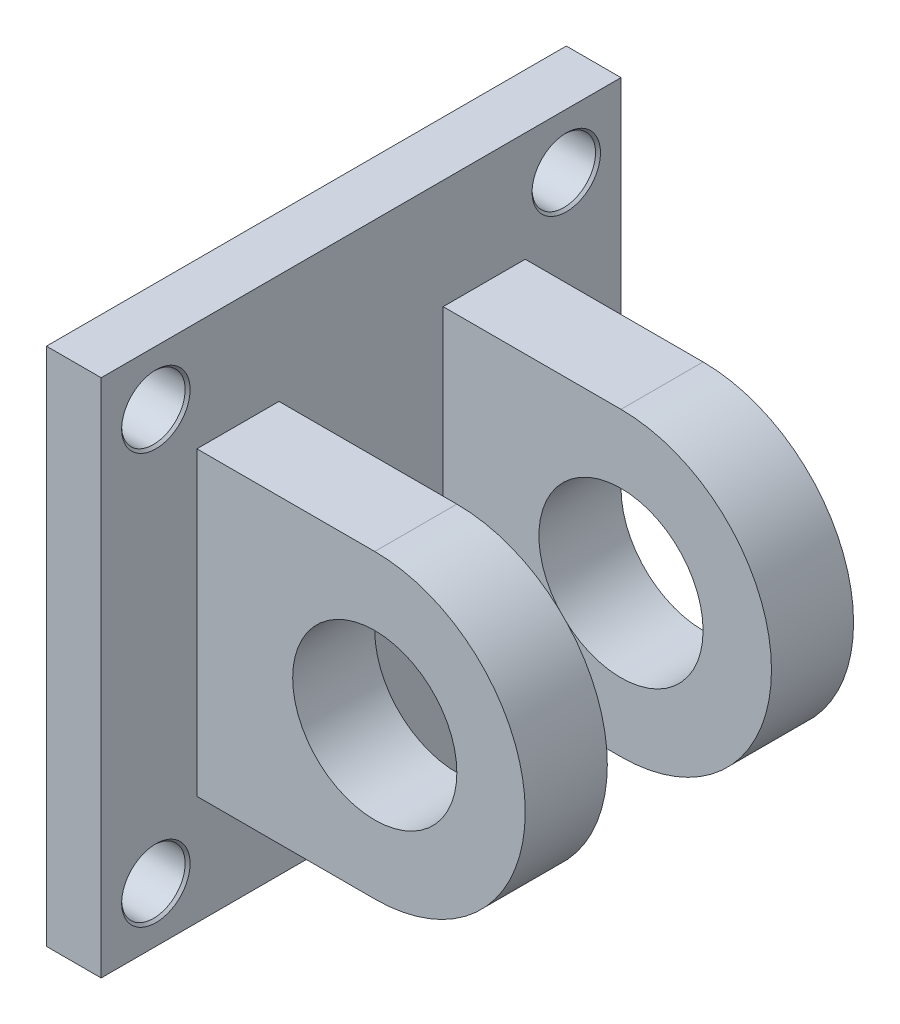
from build123d import *

# Parameters (mm, degrees)
SKETCH1_W                     = 241.3
SKETCH1_H                     = 241.3
BOSS_EXTRUDE1_DEPTH           = 25.4
BOSS_EXTRUDE2_DEPTH           = 38.1
BOSS_EXTRUDE3_START           = -38.1
BOSS_EXTRUDE3_DEPTH           = 38.1
F_1_1_8_CLEARANCE_HOLE1_D     = 29.45892
F_1_1_8_CLEARANCE_HOLE1_DEPTH = 177.8
F_1_1_8_CLEARANCE_HOLE2_D     = 29.45892
SKETCH8_W                     = 38.1
SKETCH8_H                     = 82.55
HOLE2_D                       = 76.2
HOLE2_DEPTH                   = 82.55
CHAMFER1_SIZE                 = 1.14554


with BuildPart() as part:
    # Sketch1 → Boss-Extrude1 (new body)
    with BuildSketch(Plane(origin=(25.4, 0, 0), x_dir=(0, 0, -1), z_dir=(1, 0, 0))):
        Rectangle(SKETCH1_W, SKETCH1_H)
    extrude(amount=-BOSS_EXTRUDE1_DEPTH)

    # Sketch2 → Boss-Extrude2 (add)
    with BuildSketch(Plane(origin=(0, 0, -76.2), x_dir=(-1, 0, 0), z_dir=(0, 0, -1))):
        with BuildLine():
            Line((-25.4, -69.85), (-25.4, 69.85))
            Line((-25.4, 69.85), (-107.95, 69.85))
            ThreePointArc((-107.95, 69.85), (-177.8, 0), (-107.95, -69.85))
            Line((-107.95, -69.85), (-25.4, -69.85))
        make_face()
    extrude(amount=-BOSS_EXTRUDE2_DEPTH)

    # Sketch3 → Boss-Extrude3 (add)
    with BuildSketch(Plane.XY.offset(76.2).offset(BOSS_EXTRUDE3_START)):
        with BuildLine():
            Line((25.4, 69.85), (25.4, -69.85))
            Line((25.4, -69.85), (107.95, -69.85))
            ThreePointArc((107.95, -69.85), (177.8, 0), (107.95, 69.85))
            Line((107.95, 69.85), (25.4, 69.85))
        make_face()
    extrude(amount=BOSS_EXTRUDE3_DEPTH)

    # 1-1/8 Clearance Hole1
    with Locations(Plane.ZY):
        with Locations((-95.25, -95.25), (95.25, -95.25)):
            Hole(F_1_1_8_CLEARANCE_HOLE1_D / 2, depth=F_1_1_8_CLEARANCE_HOLE1_DEPTH)

    # 1-1/8 Clearance Hole2 (through all)
    with Locations(Plane(origin=(25.4, 0, 0), x_dir=(0, 0, -1), z_dir=(1, 0, 0))):
        with Locations((-95.25, 95.25), (95.25, 95.25)):
            Hole(F_1_1_8_CLEARANCE_HOLE2_D / 2)

    # Sketch8 → Hole1 (revolve, cut)
    with BuildSketch(Plane(origin=(107.95, 0, 38.1), x_dir=(0, 1, 0), z_dir=(1, 0, 0))):
        with Locations((19.05, 41.275)):
            Rectangle(SKETCH8_W, SKETCH8_H)
    revolve(axis=Axis((107.95, 0, 148.1), (0, 0, -1)), mode=Mode.SUBTRACT)

    # Hole2
    with Locations(Plane.XY.offset(-38.1)):
        with Locations((107.95, 0)):
            Hole(HOLE2_D / 2, depth=HOLE2_DEPTH)

    # Chamfer1
    chamfer1_edges = [part.edges().sort_by_distance(p)[0] for p in [
        (25.4, -95.25, 109.97946),
        (0, -95.25, 109.97946),
        (25.4, -95.25, -80.52054),
        (0, -95.25, -80.52054),
        (25.4, 95.25, -109.97946),
        (0, 95.25, -109.97946),
        (25.4, 95.25, 80.52054),
        (0, 95.25, 80.52054),
    ]]
    chamfer(chamfer1_edges, length=CHAMFER1_SIZE)


solid = part.part
